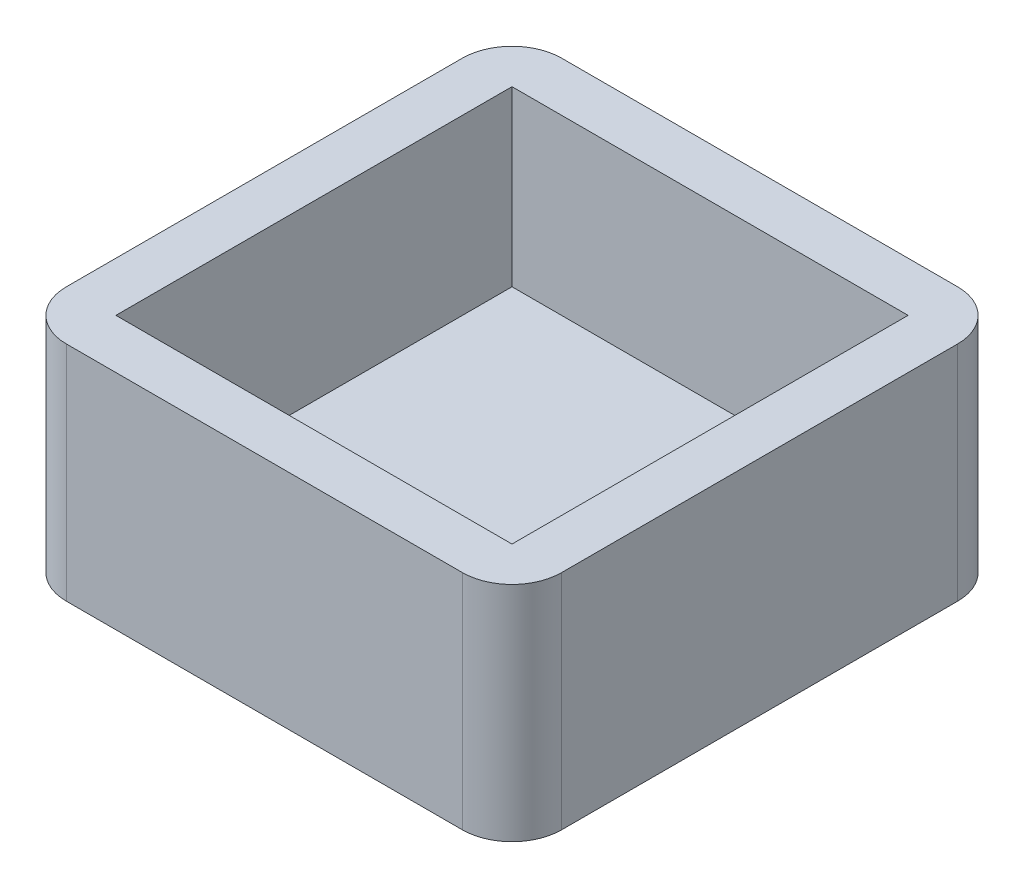
from build123d import *

# Parameters (mm, degrees)
SKETCH3_W           = 100
SKETCH3_H           = 100
BOSS_EXTRUDE1_DEPTH = 10
SKETCH4_W           = 100
SKETCH4_H           = 100
SKETCH4_W_2         = 80
SKETCH4_H_2         = 80
BOSS_EXTRUDE2_DEPTH = 35
FILLET1_R           = 10


with BuildPart() as part:
    # Sketch3 → Boss-Extrude1 (new body)
    with BuildSketch(Plane(origin=(0, 0, 0), x_dir=(1, 0, 0), z_dir=(0, 1, 0))):
        with Locations((50, 50)):
            Rectangle(SKETCH3_W, SKETCH3_H)
    extrude(amount=BOSS_EXTRUDE1_DEPTH)

    # Sketch4 → Boss-Extrude2 (add)
    with BuildSketch(Plane(origin=(0, 10, 0), x_dir=(1, 0, 0), z_dir=(0, 1, 0))):
        with Locations((50, 50)):
            Rectangle(SKETCH4_W, SKETCH4_H)
        with Locations((50, 50)):
            Rectangle(SKETCH4_W_2, SKETCH4_H_2, mode=Mode.SUBTRACT)
    extrude(amount=BOSS_EXTRUDE2_DEPTH)

    # Fillet1
    fillet1_edges = [part.edges().sort_by_distance(p)[0] for p in [
        (0, 22.5, -100),
        (100, 22.5, -100),
        (100, 22.5, 0),
        (0, 22.5, 0),
    ]]
    fillet(fillet1_edges, radius=FILLET1_R)


solid = part.part
